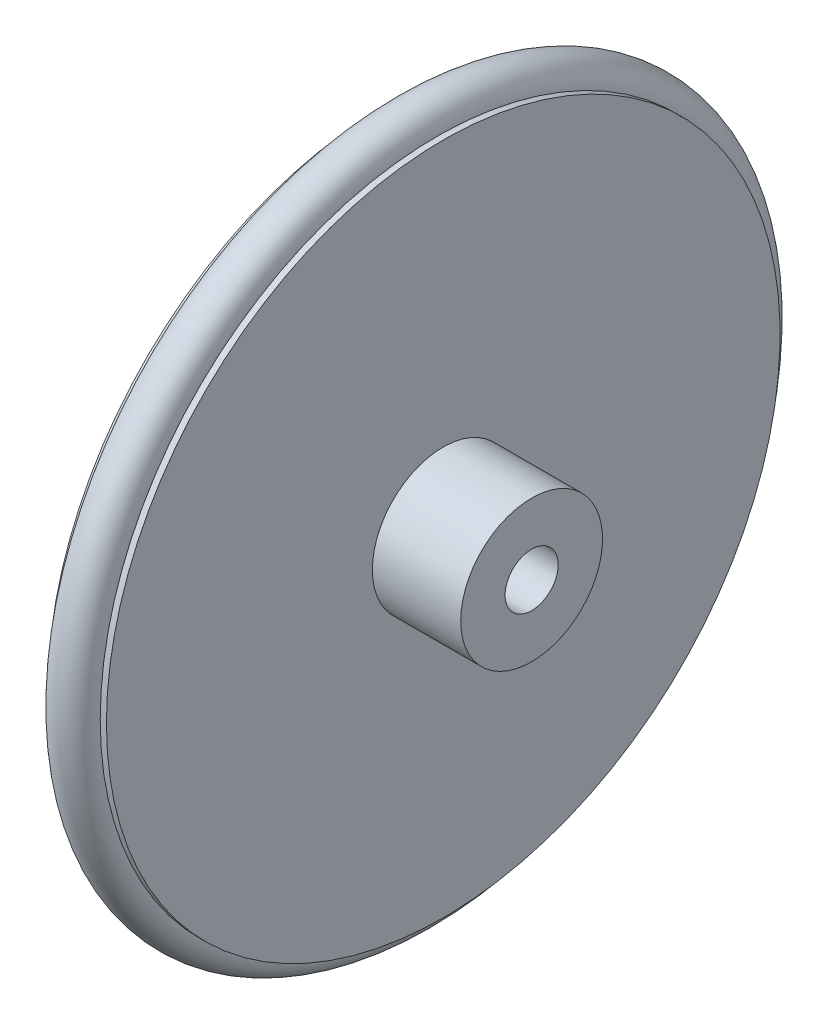
from build123d import *

# Parameters (mm, degrees)
ESQUISSE2_R             = 3
ENL_V_MAT_EXTRU_1_DEPTH = 57.236686424
ESQUISSE5_R             = 2.5


with BuildPart() as part:
    # Esquisse1 → Révolution1 (revolve)
    with BuildSketch(Plane.XY, mode=Mode.PRIVATE) as r_volution1_sk:
        Polygon((0, 0), (16.57, 0), (16.57, 8), (6.6, 8), (6.6, 38), (5.9, 38), (5.9, 35), (0.7, 35), (0.7, 38), (0, 38), align=None)
    revolve(r_volution1_sk.sketch.rotate(Axis((-19.945085304, 0, 0), (1, 0, 0)), 90), axis=Axis((-19.945085304, 0, 0), (1, 0, 0)))

    # Esquisse2 → Enlèv. mat.-Extru.1 (cut, through all)
    with BuildSketch(Plane(origin=(16.57, 0, 0), x_dir=(0, 0, -1), z_dir=(1, 0, 0))):
        Circle(ESQUISSE2_R)
    extrude(amount=-ENL_V_MAT_EXTRU_1_DEPTH, mode=Mode.SUBTRACT)


with BuildPart() as body_2:
    # Balayage1: sweep along a path in Esquisse4
    with BuildLine(Plane(origin=(3.3, 0, 0), x_dir=(0, 0, -1), z_dir=(1, 0, 0))) as balayage1_path:
        CenterArc((0, 0), 38.5, 0, 360)
    # Esquisse5 → Balayage1 (sweep)
    with BuildSketch(Plane.XY):
        with Locations((3.3, 38)):
            Circle(ESQUISSE5_R)
    sweep(path=balayage1_path.line)


solid = Compound([part.part, body_2.part])
